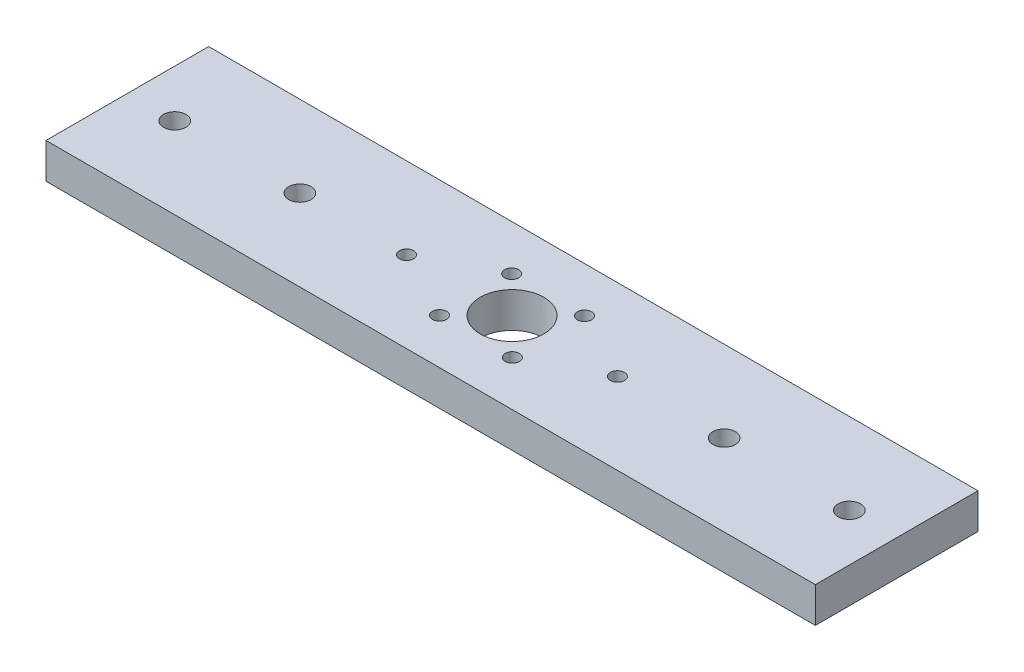
from build123d import *

# Parameters (mm, degrees)
SKETCH1_W                 = 108.8
SKETCH1_H                 = 23
MOUNT_BASE_DEPTH          = 5
SKETCH2_R                 = 1
SKETCH2_R_2               = 4.5
BRACKET_SCREW_HOLES_DEPTH = 5
SKETCH3_R                 = 1.5875
ANTENNA_SCREW_HOLES_DEPTH = 5


with BuildPart() as part:
    # Sketch1 → Mount Base (new body)
    with BuildSketch(Plane(origin=(0, 0, 0), x_dir=(1, 0, 0), z_dir=(0, 1, 0))):
        with Locations((54.4, 11.5)):
            Rectangle(SKETCH1_W, SKETCH1_H)
    extrude(amount=MOUNT_BASE_DEPTH)

    # Sketch2 → Bracket Screw Holes (cut)
    with BuildSketch(Plane(origin=(0, 5, 0), x_dir=(1, 0, 0), z_dir=(0, 1, 0))):
        with Locations(Location((59.55, 16.6, 0), (0, 0, 270))):
            Circle(SKETCH2_R)
        with Locations(Location((59.55, 6.4, 0), (0, 0, 270))):
            Circle(SKETCH2_R)
        with Locations(Location((49.25, 6.4, 0), (0, 0, 270))):
            Circle(SKETCH2_R)
        with Locations(Location((49.25, 16.6, 0), (0, 0, 270))):
            Circle(SKETCH2_R)
        with Locations(Location((69.31, 11.5, 0), (0, 0, 270))):
            Circle(SKETCH2_R)
        with Locations(Location((39.49, 11.5, 0), (0, 0, 270))):
            Circle(SKETCH2_R)
        with Locations(Location((54.4, 11.5, 0), (0, 0, 270))):
            Circle(SKETCH2_R_2)
    extrude(amount=-BRACKET_SCREW_HOLES_DEPTH, mode=Mode.SUBTRACT)

    # Sketch3 → Antenna Screw Holes (cut)
    with BuildSketch(Plane(origin=(0, 5, 0), x_dir=(1, 0, 0), z_dir=(0, 1, 0))):
        with Locations(Location((6.7, 11.5, 0), (0, 0, 270))):
            Circle(SKETCH3_R)
        with Locations(Location((24.4, 11.5, 0), (0, 0, 270))):
            Circle(SKETCH3_R)
        with Locations(Location((84.4, 11.5, 0), (0, 0, 270))):
            Circle(SKETCH3_R)
        with Locations(Location((102.1, 11.5, 0), (0, 0, 270))):
            Circle(SKETCH3_R)
    extrude(amount=-ANTENNA_SCREW_HOLES_DEPTH, mode=Mode.SUBTRACT)


solid = part.part
